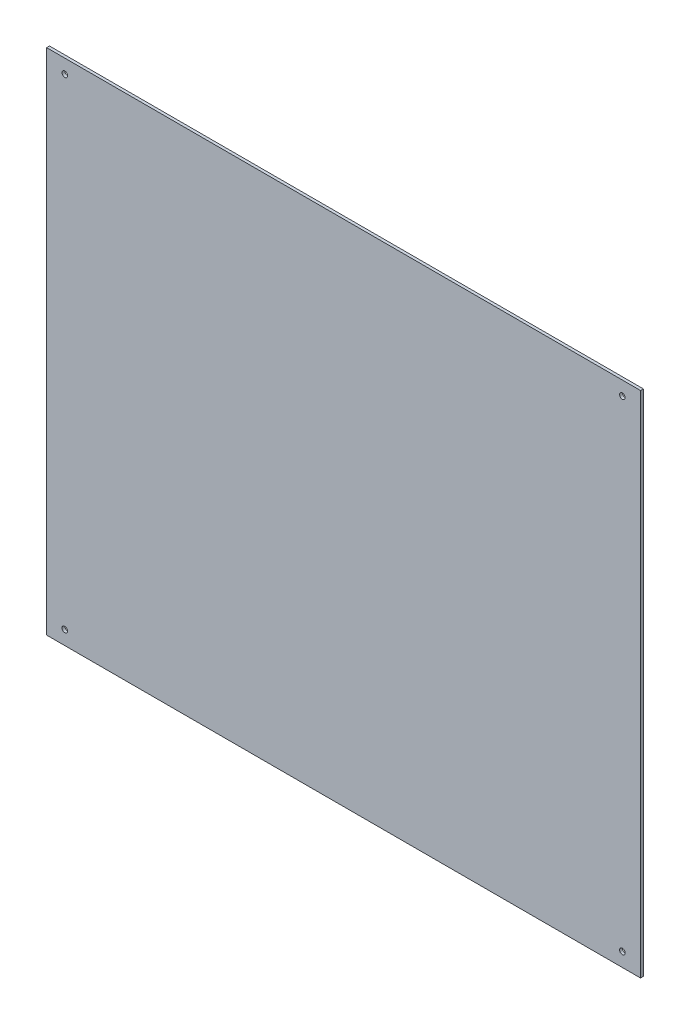
from build123d import *

# Parameters (mm, degrees)
SKETCH1_W           = 426
SKETCH1_H           = 365
SKETCH1_R           = 2
BOSS_EXTRUDE1_DEPTH = 2.032


with BuildPart() as part:
    # Sketch1 → Boss-Extrude1 (new body)
    with BuildSketch(Plane.XY):
        Rectangle(SKETCH1_W, SKETCH1_H)
        with Locations((200, 172.5)):
            Circle(SKETCH1_R, mode=Mode.SUBTRACT)
        with Locations((-200, -172.5)):
            Circle(SKETCH1_R, mode=Mode.SUBTRACT)
        with Locations((200, -172.5)):
            Circle(SKETCH1_R, mode=Mode.SUBTRACT)
        with Locations((-200, 172.5)):
            Circle(SKETCH1_R, mode=Mode.SUBTRACT)
    extrude(amount=BOSS_EXTRUDE1_DEPTH)


solid = part.part
